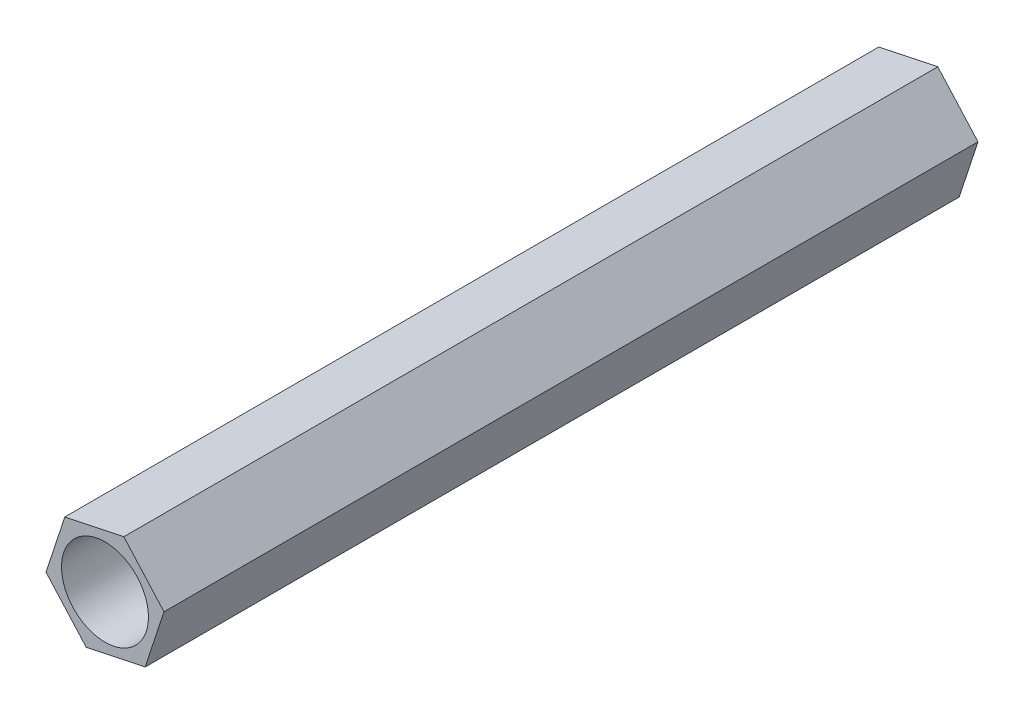
from build123d import *

# Parameters (mm, degrees)
BOSS_EXTRUDE4_DEPTH = 46.8
SKETCH4_R           = 2.5
CUT_EXTRUDE3_DEPTH  = 15
CUT_EXTRUDE4_START  = -15
SKETCH5_R           = 2.5
CUT_EXTRUDE4_DEPTH  = 15


with BuildPart() as part:
    # Sketch1 → Boss-Extrude4 (new body)
    with BuildSketch(Plane.XY):
        Polygon((3.39082447, 0.708737902), (1.081627208, 3.290909082), (-2.309197262, 2.58217118), (-3.39082447, -0.708737902), (-1.081627208, -3.290909082), (2.309197262, -2.58217118), align=None)
    extrude(amount=BOSS_EXTRUDE4_DEPTH)

    # Sketch4 → Cut-Extrude3 (cut)
    with BuildSketch(Plane.XY.offset(46.8)):
        Circle(SKETCH4_R)
    extrude(amount=-CUT_EXTRUDE3_DEPTH, mode=Mode.SUBTRACT)

    # Sketch5 → Cut-Extrude4 (cut)
    with BuildSketch(Plane(origin=(0, 0, 0), x_dir=(-1, 0, 0), z_dir=(0, 0, -1)).offset(CUT_EXTRUDE4_START)):
        with Locations(Location((0, 0, 0), (0, 0, 180))):
            Circle(SKETCH5_R)
    extrude(amount=CUT_EXTRUDE4_DEPTH, mode=Mode.SUBTRACT)


solid = part.part
